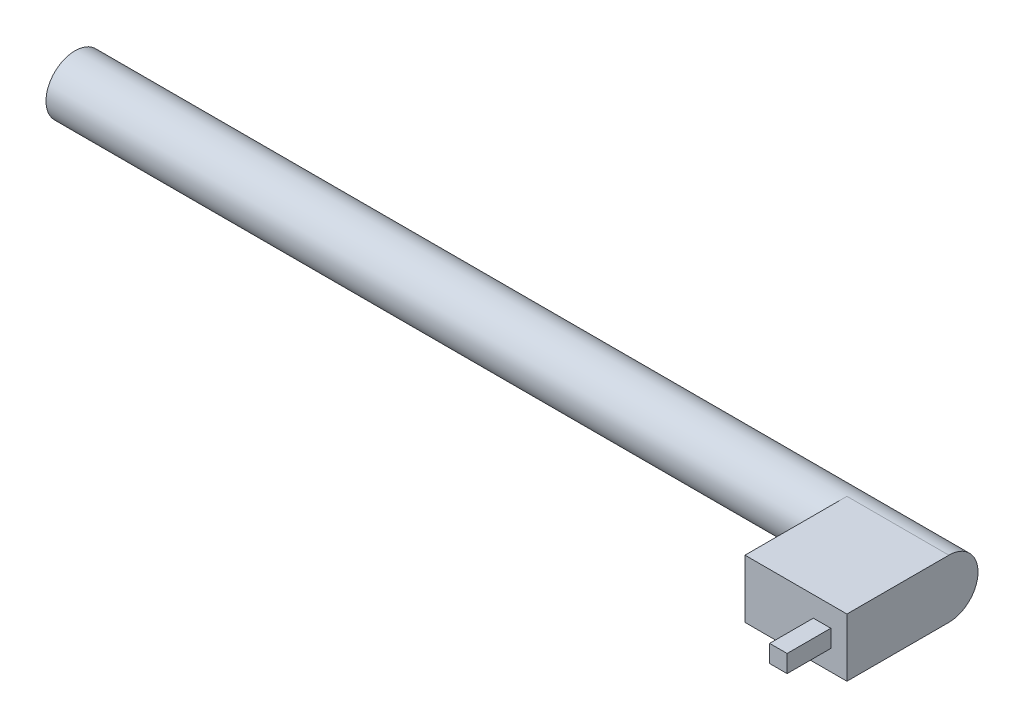
from build123d import *

# Parameters (mm, degrees)
SKETCH_1_R      = 10
EXTRUDE_1_DEPTH = 150
SKETCH_2_W      = 35
SKETCH_2_H      = 20
EXTRUDE_2_DEPTH = 35
SKETCH_3_W      = 6
SKETCH_3_H      = 6
SKETCH_3_R      = 0.5
EXTRUDE_3_DEPTH = 15


with BuildPart() as part:
    # 草图1 → 凸台-拉伸1 (new, symmetric)
    with BuildSketch(Plane(origin=(0, 0, 0), x_dir=(0, 0, -1), z_dir=(1, 0, 0))):
        Circle(SKETCH_1_R)
    extrude(amount=EXTRUDE_1_DEPTH, both=True)

    # 草图2 → 凸台-拉伸2 (add)
    with BuildSketch(Plane.XY):
        with Locations((132.5, 0)):
            Rectangle(SKETCH_2_W, SKETCH_2_H)
    extrude(amount=EXTRUDE_2_DEPTH)

    # 草图3 → 凸台-拉伸3 (add)
    # profile 1 of 2: a face of its own
    with BuildSketch(Plane.XY.offset(35)):
        with Locations((141.458586474, 0)):
            Rectangle(SKETCH_3_W, SKETCH_3_H)
        with Locations((141.458586474, 0)):
            Circle(SKETCH_3_R, mode=Mode.SUBTRACT)
    # profile 2 of 2: a face of its own
    with BuildSketch(Plane.XY.offset(35)):
        with Locations((141.458586474, 0)):
            Circle(SKETCH_3_R)
    extrude(amount=EXTRUDE_3_DEPTH)


solid = part.part
